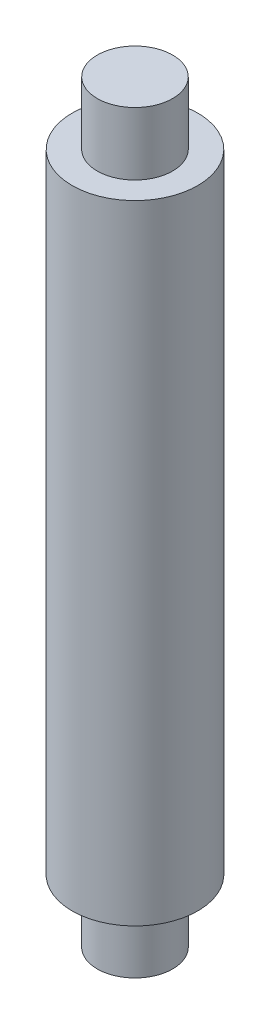
from build123d import *


with BuildPart() as part:
    # Croquis1 → Revolución1 (revolve)
    with BuildSketch(Plane.XY, mode=Mode.PRIVATE) as revoluci_n1_sk:
        Polygon((0, 0), (-6, 0), (-6, 10), (-10, 10), (-10, 110), (-6, 110), (-6, 120), (0, 120), align=None)
    revolve(revoluci_n1_sk.sketch.rotate(Axis((0, 120, 0), (0, -1, 0)), 270), axis=Axis((0, 120, 0), (0, -1, 0)))


solid = part.part
